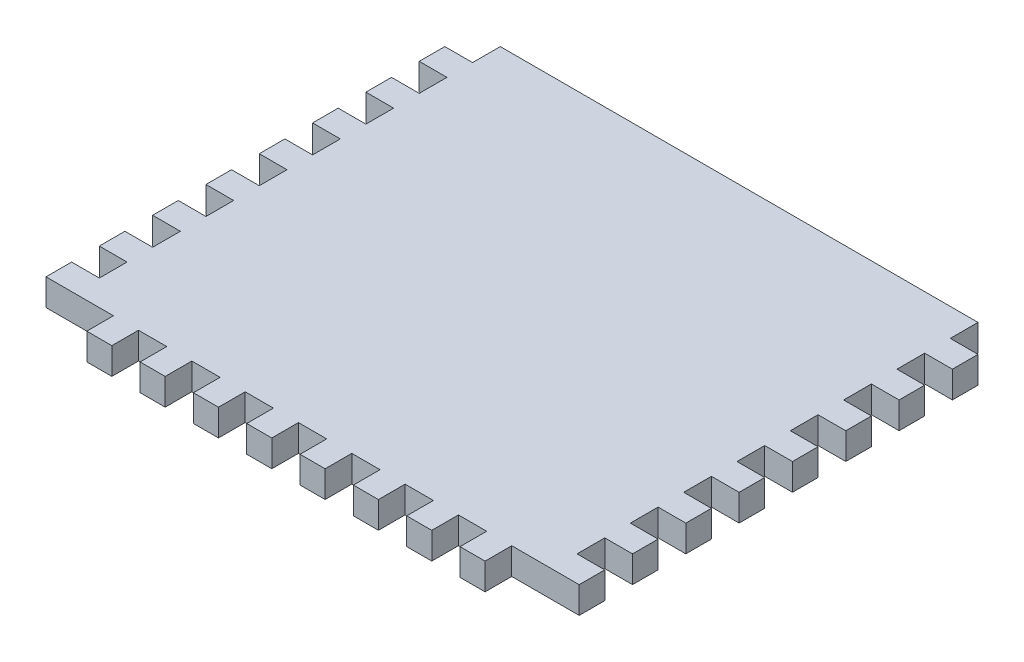
from build123d import *

# Parameters (mm, degrees)
SKETCH1_W           = 127
SKETCH1_H           = 107.95
BOSS_EXTRUDE1_DEPTH = 6.35
SKETCH2_W           = 6.604
SKETCH2_H           = 6.604
CUT_EXTRUDE1_DEPTH  = 84.58153579


with BuildPart() as part:
    # Sketch1 → Boss-Extrude1 (new body)
    with BuildSketch(Plane(origin=(0, 0, 0), x_dir=(1, 0, 0), z_dir=(0, 1, 0))):
        Rectangle(SKETCH1_W, SKETCH1_H)
    extrude(amount=BOSS_EXTRUDE1_DEPTH)

    # Sketch2 → Cut-Extrude1 (cut, through all)
    with BuildSketch(Plane.XZ):
        Polygon((-34.7345, 47.625), (-41.4655, 47.625), (-41.4655, 54.229), (-47.4345, 54.229), (-47.4345, 47.625), (-56.896, 47.625), (-63.5, 47.625), (-63.5, 54.229), (-63.5, 63.03162391), (63.5, 63.03162391), (63.5, 54.229), (63.5, 47.625), (56.896, 47.625), (47.4345, 47.625), (47.4345, 54.229), (41.4655, 54.229), (41.4655, 47.625), (34.7345, 47.625), (34.7345, 54.229), (28.7655, 54.229), (28.7655, 47.625), (22.0345, 47.625), (22.0345, 54.229), (16.0655, 54.229), (16.0655, 47.625), (9.3345, 47.625), (9.3345, 54.229), (3.3655, 54.229), (3.3655, 47.625), (-3.3655, 47.625), (-3.3655, 54.229), (-9.3345, 54.229), (-9.3345, 47.625), (-16.0655, 47.625), (-16.0655, 54.229), (-22.0345, 54.229), (-22.0345, 47.625), (-28.7655, 47.625), (-28.7655, 54.229), (-34.7345, 54.229), align=None)
        with Locations((60.198, 38.227)):
            Rectangle(SKETCH2_W, SKETCH2_H)
        with Locations((60.198, 25.527)):
            Rectangle(SKETCH2_W, SKETCH2_H)
        with Locations((60.198, 12.827)):
            Rectangle(SKETCH2_W, SKETCH2_H)
        with Locations((60.198, 0.127)):
            Rectangle(SKETCH2_W, SKETCH2_H)
        with Locations((60.198, -12.573)):
            Rectangle(SKETCH2_W, SKETCH2_H)
        with Locations((60.198, -25.273)):
            Rectangle(SKETCH2_W, SKETCH2_H)
        with Locations((60.198, -37.973)):
            Rectangle(SKETCH2_W, SKETCH2_H)
        with Locations((-60.198, -37.973)):
            Rectangle(SKETCH2_W, SKETCH2_H)
        with Locations((-60.198, -25.273)):
            Rectangle(SKETCH2_W, SKETCH2_H)
        with Locations((-60.198, -12.573)):
            Rectangle(SKETCH2_W, SKETCH2_H)
        with Locations((-60.198, 0.127)):
            Rectangle(SKETCH2_W, SKETCH2_H)
        with Locations((-60.198, 12.827)):
            Rectangle(SKETCH2_W, SKETCH2_H)
        with Locations((-60.198, 25.527)):
            Rectangle(SKETCH2_W, SKETCH2_H)
        with Locations((-60.198, 38.227)):
            Rectangle(SKETCH2_W, SKETCH2_H)
        with Locations((60.198, -50.673)):
            Rectangle(SKETCH2_W, SKETCH2_H)
        with Locations((-60.198, -50.673)):
            Rectangle(SKETCH2_W, SKETCH2_H)
    extrude(amount=-CUT_EXTRUDE1_DEPTH, mode=Mode.SUBTRACT)


solid = part.part
